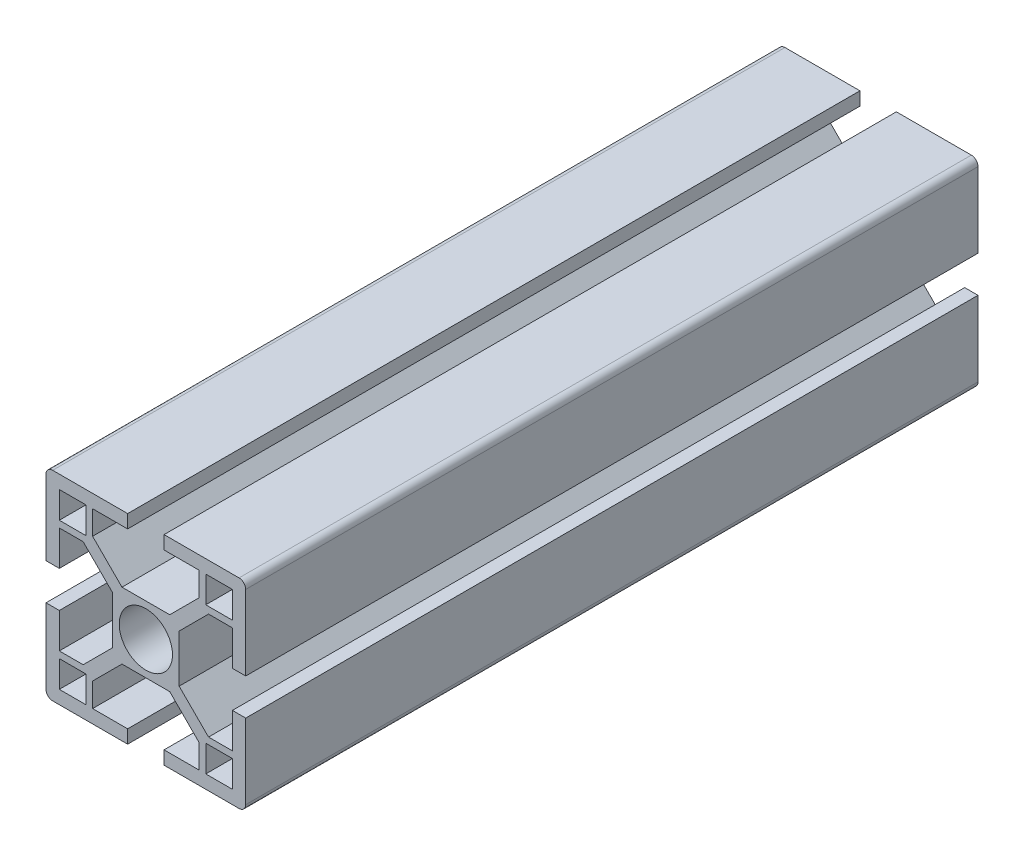
from build123d import *

# Parameters (mm, degrees)
SKETCH_1_W          = 30
SKETCH_1_H          = 30
EXTRUDE_1_DEPTH     = 110
SKETCH_2_R          = 4
SKETCH_2_W          = 4
SKETCH_2_H          = 4
CUT_EXTRUDE_1_DEPTH = 113.026782512
FILLET_2_R          = 1


with BuildPart() as part:
    # 草图1 → 凸台-拉伸1 (new body)
    with BuildSketch(Plane.XY):
        Rectangle(SKETCH_1_W, SKETCH_1_H)
    extrude(amount=EXTRUDE_1_DEPTH)

    # 草图2 → 切除-拉伸1 (cut, through all)
    with BuildSketch(Plane.XY.offset(110)):
        Circle(SKETCH_2_R)
        Polygon((-8, 9.414213562), (-3.585786438, 5), (3.585786438, 5), (8, 9.414213562), (8, 13), (2.735613527, 13), (2.735613527, 15), (-2.735613527, 15), (-2.735613527, 13), (-8, 13), align=None)
        Polygon((-5, -3.585786438), (-5, 3.585786438), (-9.414213562, 8), (-13, 8), (-13, 2.735613527), (-15, 2.735613527), (-15, -2.735613527), (-13, -2.735613527), (-13, -8), (-9.414213562, -8), align=None)
        Polygon((3.585786438, -5), (-3.585786438, -5), (-8, -9.414213562), (-8, -13), (-2.735613527, -13), (-2.735613527, -15), (2.735613527, -15), (2.735613527, -13), (8, -13), (8, -9.414213562), align=None)
        Polygon((9.414213562, 8), (5, 3.585786438), (5, -3.585786438), (9.414213562, -8), (13, -8), (13, -2.735613527), (15, -2.735613527), (15, 2.735613527), (13, 2.735613527), (13, 8), align=None)
        with Locations((-11, 11)):
            Rectangle(SKETCH_2_W, SKETCH_2_H)
        with Locations((11, 11)):
            Rectangle(SKETCH_2_W, SKETCH_2_H)
        with Locations((11, -11)):
            Rectangle(SKETCH_2_W, SKETCH_2_H)
        with Locations((-11, -11)):
            Rectangle(SKETCH_2_W, SKETCH_2_H)
    extrude(amount=-CUT_EXTRUDE_1_DEPTH, mode=Mode.SUBTRACT)

    # 圆角2
    fillet_2_edges = [part.edges().sort_by_distance(p)[0] for p in [
        (-15, 15, 55),
        (15, 15, 55),
        (15, -15, 55),
        (-15, -15, 55),
    ]]
    fillet(fillet_2_edges, radius=FILLET_2_R)


solid = part.part
